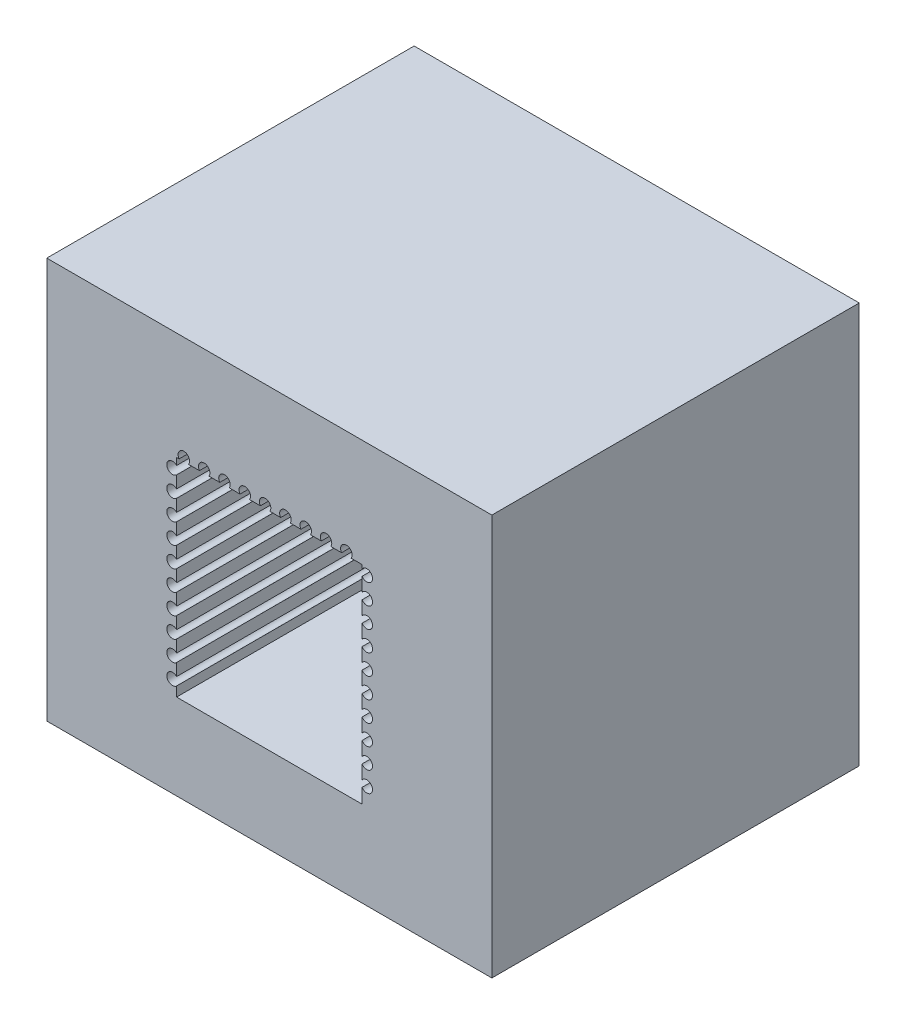
from build123d import *

# Parameters (mm, degrees)
SKETCH1_W           = 504
SKETCH1_H           = 454
BOSS_EXTRUDE1_DEPTH = 416
SKETCH2_W           = 260
SKETCH2_H           = 260
CUT_EXTRUDE1_DEPTH  = 260
BOSS_EXTRUDE2_DEPTH = 260
SKETCH6_R           = 6.5
CUT_EXTRUDE2_DEPTH  = 260
LPATTERN3_COUNT     = 10
LPATTERN3_PITCH     = 23
SKETCH7_R           = 6.5
CUT_EXTRUDE3_DEPTH  = 260
LPATTERN4_COUNT     = 10
LPATTERN4_PITCH     = 23
SKETCH8_R           = 6.5
CUT_EXTRUDE4_DEPTH  = 260
LPATTERN5_COUNT     = 9
LPATTERN5_PITCH     = 23


with BuildPart() as part:
    # Sketch1 → Boss-Extrude1 (new body)
    with BuildSketch(Plane.XY):
        Rectangle(SKETCH1_W, SKETCH1_H)
    extrude(amount=-BOSS_EXTRUDE1_DEPTH)

    # Sketch2 → Cut-Extrude1 (cut)
    with BuildSketch(Plane.XY):
        Rectangle(SKETCH2_W, SKETCH2_H)
    extrude(amount=-CUT_EXTRUDE1_DEPTH, mode=Mode.SUBTRACT)

    # Sketch5 → Boss-Extrude2 (add)
    with BuildSketch(Plane.XY):
        Polygon((-105, 130), (-130, 130), (-130, 105), (-130, -130), (-105, -130), (-105, 105), (105, 105), (105, -130), (130, -130), (130, 105), (130, 130), (105, 130), align=None)
    extrude(amount=-BOSS_EXTRUDE2_DEPTH)

    # Sketch6 → Cut-Extrude2 (cut)
    with BuildSketch(Plane.XY):
        with Locations((-109.593002072, 92.497724269)):
            Circle(SKETCH6_R)
    cut_extrude2 = extrude(amount=-CUT_EXTRUDE2_DEPTH, mode=Mode.SUBTRACT)

    # LPattern3: Cut-Extrude2 ×10
    with Locations(*[(0, -i * LPATTERN3_PITCH, 0) for i in range(1, LPATTERN3_COUNT)]):
        add(cut_extrude2, mode=Mode.SUBTRACT)

    # Sketch7 → Cut-Extrude3 (cut)
    with BuildSketch(Plane.XY):
        with Locations((110.371561269, 97.109609101)):
            Circle(SKETCH7_R)
    cut_extrude3 = extrude(amount=-CUT_EXTRUDE3_DEPTH, mode=Mode.SUBTRACT)

    # LPattern4: Cut-Extrude3 ×10
    with Locations(*[(0, -i * LPATTERN4_PITCH, 0) for i in range(1, LPATTERN4_COUNT)]):
        add(cut_extrude3, mode=Mode.SUBTRACT)

    # Sketch8 → Cut-Extrude4 (cut)
    with BuildSketch(Plane.XY):
        with Locations((-96.786646696, 108.681954404)):
            Circle(SKETCH8_R)
    cut_extrude4 = extrude(amount=-CUT_EXTRUDE4_DEPTH, mode=Mode.SUBTRACT)

    # LPattern5: Cut-Extrude4 ×9
    with Locations(*[(i * LPATTERN5_PITCH, 0, 0) for i in range(1, LPATTERN5_COUNT)]):
        add(cut_extrude4, mode=Mode.SUBTRACT)


solid = part.part
